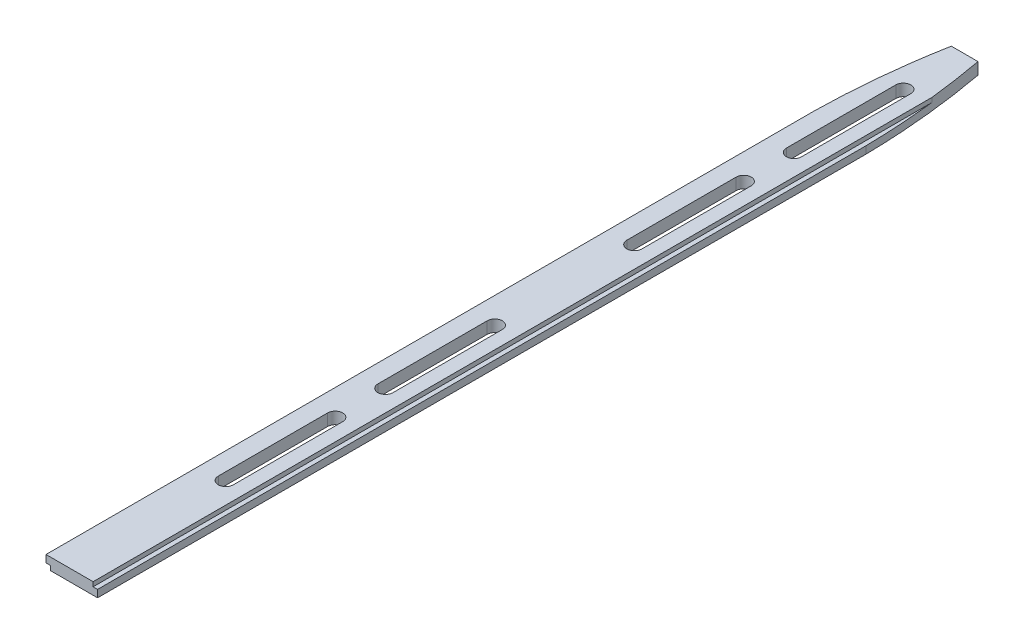
from build123d import *

# Parameters (mm, degrees)
IZIM1_W                     = 23.2
IZIM1_H                     = 7.3
Y_KSEKLIK_EKSTR_ZYON1_DEPTH = 401.7
KES_EKSTR_ZYON1_DEPTH       = 402.7
KES_EKSTR_ZYON2_DEPTH       = 402.7
KES_EKSTR_ZYON3_DEPTH       = 402.7


with BuildPart() as part:
    # Çizim1 → Yükseklik-Ekstrüzyon1 (new body)
    with BuildSketch(Plane.XY):
        with Locations((11.6, 3.65)):
            Rectangle(IZIM1_W, IZIM1_H)
    extrude(amount=Y_KSEKLIK_EKSTR_ZYON1_DEPTH)

    # Çizim2 → Kes-Ekstrüzyon1 (cut)
    with BuildSketch(Plane.XY.offset(401.7)):
        Polygon((21.2, 7.3), (23.2, 7.3), (23.2, 4.3), (21.2, 4.3), (21.2, 6.3), (0, 6.3), (0, 7.3), align=None)
        Polygon((0, 0), (2, 0), (23.2, 0), (23.2, 1), (2, 1), (2, 3), (0, 3), align=None)
    extrude(amount=-KES_EKSTR_ZYON1_DEPTH, mode=Mode.SUBTRACT)

    # Çizim3 → Kes-Ekstrüzyon2 (cut)
    with BuildSketch(Plane(origin=(0, 6.3, 0), x_dir=(1, 0, 0), z_dir=(0, 1, 0))):
        with BuildLine():
            Line((0, 0), (5.6, 0))
            add(Edge.make_bspline(
                [(5.6, 0), (0.42062512, -27.8813272), (0, -56)],
                knots=[0, 0, 0, 0.849776743, 0.849776743, 0.849776743], degree=2))
            Line((0, -56), (0, 0))
        make_face()
        with BuildLine():
            Line((23.2, 0), (23.2, -56))
            add(Edge.make_bspline(
                [(17.6, 0), (22.77937488, -27.8813272), (23.2, -56)],
                knots=[0, 0, 0, 0.849776743, 0.849776743, 0.849776743], degree=2))
            Line((17.6, 0), (23.2, 0))
        make_face()
    extrude(amount=-KES_EKSTR_ZYON2_DEPTH, mode=Mode.SUBTRACT)

    # Çizim4 → Kes-Ekstrüzyon3 (cut)
    with BuildSketch(Plane(origin=(0, 6.3, 0), x_dir=(1, 0, 0), z_dir=(0, 1, 0))):
        with BuildLine():
            Line((8.2, -27.6), (8.2, -76.8))
            ThreePointArc((8.2, -76.8), (11.6, -80.2), (15, -76.8))
            Line((15, -76.8), (15, -27.6))
            ThreePointArc((15, -27.6), (11.6, -24.2), (8.2, -27.6))
        make_face()
        with BuildLine():
            Line((8.2, -99.4), (8.2, -148.6))
            ThreePointArc((8.2, -148.6), (11.6, -152), (15, -148.6))
            Line((15, -148.6), (15, -99.4))
            ThreePointArc((15, -99.4), (11.6, -96), (8.2, -99.4))
        make_face()
        with BuildLine():
            Line((8.2, -211.4), (8.2, -260.6))
            ThreePointArc((8.2, -260.6), (11.6, -264), (15, -260.6))
            Line((15, -260.6), (15, -211.4))
            ThreePointArc((15, -211.4), (11.6, -208), (8.2, -211.4))
        make_face()
        with BuildLine():
            Line((8.2, -283.2), (8.2, -332.4))
            ThreePointArc((8.2, -332.4), (11.6, -335.8), (15, -332.4))
            Line((15, -332.4), (15, -283.2))
            ThreePointArc((15, -283.2), (11.6, -279.8), (8.2, -283.2))
        make_face()
    extrude(amount=-KES_EKSTR_ZYON3_DEPTH, mode=Mode.SUBTRACT)


solid = part.part
